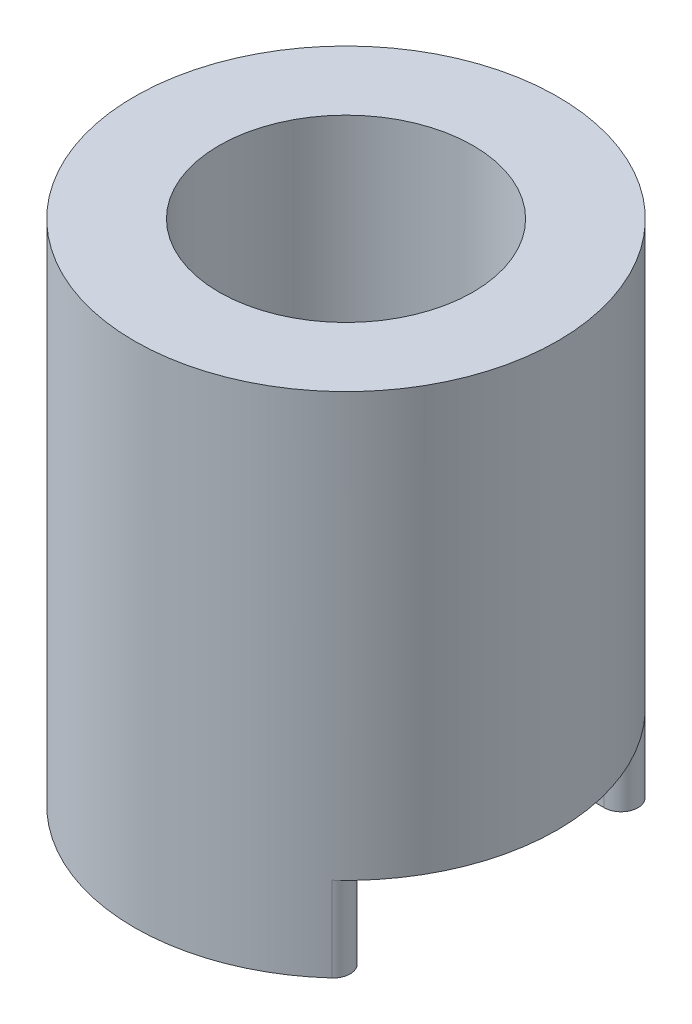
from build123d import *

# Parameters (mm, degrees)
SKETCH1_R               = 15.875
BOSS_EXTRUDE1_DEPTH     = 38.1
CUT_EXTRUDE1_DEPTH      = 45.22263278
CUT_EXTRUDE1_DEPTH_BACK = 45.22263278
SKETCH2_W               = 19.05
SKETCH2_H               = 6.35
SKETCH3_R               = 9.525
CUT_EXTRUDE2_DEPTH      = 45.22263278
FILLET1_R               = 1.27


with BuildPart() as part:
    # Sketch1 → Boss-Extrude1 (new body)
    with BuildSketch(Plane(origin=(0, 0, 0), x_dir=(1, 0, 0), z_dir=(0, 1, 0))):
        with Locations(Location((0, 0, 0), (0, 0, 270))):
            Circle(SKETCH1_R)
    extrude(amount=BOSS_EXTRUDE1_DEPTH)

    # Sketch2 → Cut-Extrude1 (cut, two sides: drawn at the far end of the back side and taken through both)
    with BuildSketch(Plane(origin=(0, 0, 0), x_dir=(0, 0, -1), z_dir=(1, 0, 0)).offset(-CUT_EXTRUDE1_DEPTH_BACK)):
        with Locations((0, 3.175)):
            Rectangle(SKETCH2_W, SKETCH2_H)
    extrude(amount=CUT_EXTRUDE1_DEPTH + CUT_EXTRUDE1_DEPTH_BACK, mode=Mode.SUBTRACT)

    # Sketch3 → Cut-Extrude2 (cut, through all)
    with BuildSketch(Plane(origin=(0, 38.1, 0), x_dir=(1, 0, 0), z_dir=(0, 1, 0))):
        with Locations(Location((0, 0, 0), (0, 0, 270))):
            Circle(SKETCH3_R)
    extrude(amount=-CUT_EXTRUDE2_DEPTH, mode=Mode.SUBTRACT)

    # Fillet1
    fillet1_edges = [part.edges().sort_by_distance(p)[0] for p in [
        (-12.7, 3.175, 9.525),
        (12.7, 3.175, 9.525),
        (12.7, 3.175, -9.525),
        (-12.7, 3.175, -9.525),
    ]]
    fillet(fillet1_edges, radius=FILLET1_R)


solid = part.part
